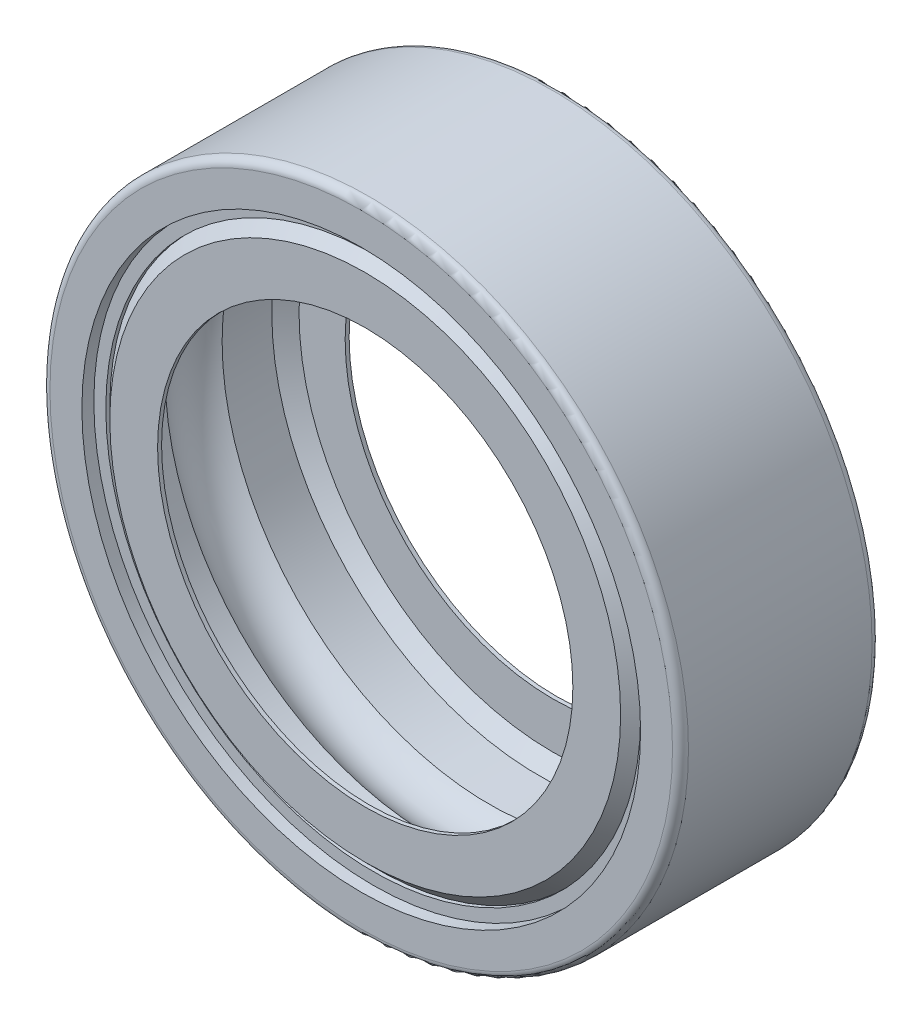
from build123d import *


with BuildPart() as part:
    # Sketch1 → Revolve1 (revolve)
    with BuildSketch(Plane(origin=(0, 0, 0), x_dir=(0, 0, -1), z_dir=(1, 0, 0)), mode=Mode.PRIVATE) as revolve1_sk:
        with BuildLine():
            Line((-2.5, 7), (-2.5, 7.8))
            ThreePointArc((-2.5, 7.8), (-2.441421356, 7.941421356), (-2.3, 8))
            Line((-2.3, 8), (2.3, 8))
            ThreePointArc((2.3, 8), (2.441421356, 7.941421356), (2.5, 7.8))
            Line((2.5, 7.8), (2.5, 7))
            Line((2.5, 7), (2.2, 7))
            Line((2.2, 7), (2.2, 6.7))
            Line((2.2, 6.7), (2.1, 6.7))
            Line((2.1, 6.7), (2.4, 6.4))
            Line((2.4, 6.4), (2.4, 5.202907901))
            Line((2.4, 5.202907901), (2.3, 5.202907901))
            Line((2.3, 5.202907901), (2.3, 6.358578644))
            Line((2.3, 6.358578644), (1.958578644, 6.7))
            Line((1.958578644, 6.7), (0.714142843, 6.7))
            ThreePointArc((0.714142843, 6.7), (0, 7), (-0.714142843, 6.7))
            Line((-0.714142843, 6.7), (-1.958578644, 6.7))
            Line((-1.958578644, 6.7), (-2.3, 6.358578644))
            Line((-2.3, 6.358578644), (-2.3, 5.202907901))
            Line((-2.3, 5.202907901), (-2.4, 5.202907901))
            Line((-2.4, 5.202907901), (-2.4, 6.4))
            Line((-2.4, 6.4), (-2.1, 6.7))
            Line((-2.1, 6.7), (-2.2, 6.7))
            Line((-2.2, 6.7), (-2.2, 7))
            Line((-2.2, 7), (-2.5, 7))
        make_face()
    revolve(revolve1_sk.sketch.rotate(Axis((0, 0, 6.755399071), (0, 0, -1)), 90), axis=Axis((0, 0, 6.755399071), (0, 0, -1)))


solid = part.part
